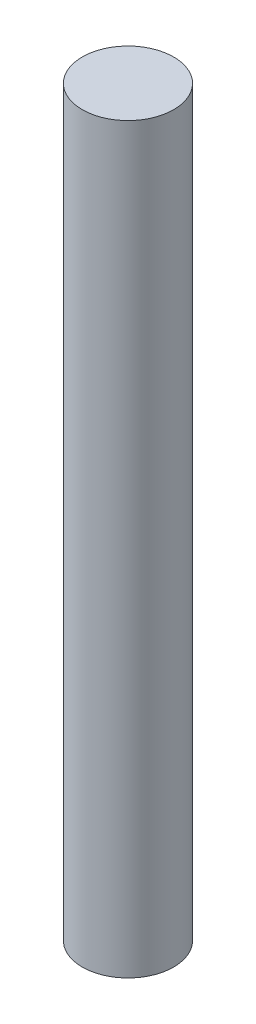
from build123d import *

# Parameters (mm, degrees)
SKETCH1_R           = 2
BOSS_EXTRUDE1_DEPTH = 32.5


with BuildPart() as part:
    # Sketch1 → Boss-Extrude1 (new body)
    with BuildSketch(Plane(origin=(0, 0, 0), x_dir=(1, 0, 0), z_dir=(0, 1, 0))):
        with Locations(Location((-9.604915896, -10.252119899, 0), (0, 0, 270))):
            Circle(SKETCH1_R)
    extrude(amount=BOSS_EXTRUDE1_DEPTH)


solid = part.part
